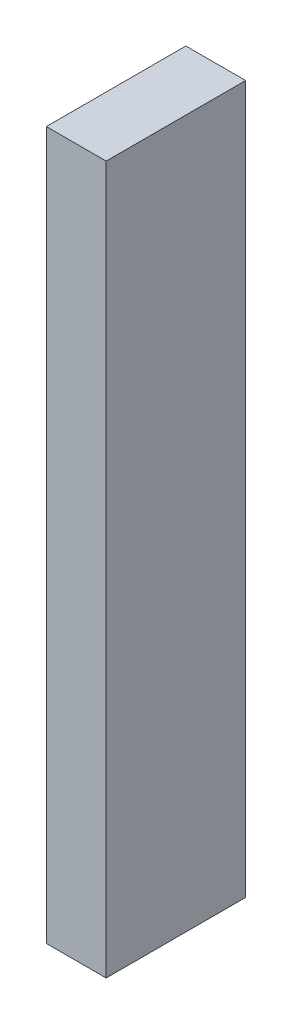
from build123d import *

# Parameters (mm, degrees)
SKETCH1_W           = 38.1
SKETCH1_H           = 88.9
BOSS_EXTRUDE1_DEPTH = 225.425


with BuildPart() as part:
    # Sketch1 → Boss-Extrude1 (new, symmetric)
    with BuildSketch(Plane(origin=(0, 0, 0), x_dir=(1, 0, 0), z_dir=(0, 1, 0))):
        Rectangle(SKETCH1_W, SKETCH1_H)
    extrude(amount=BOSS_EXTRUDE1_DEPTH, both=True)


solid = part.part
